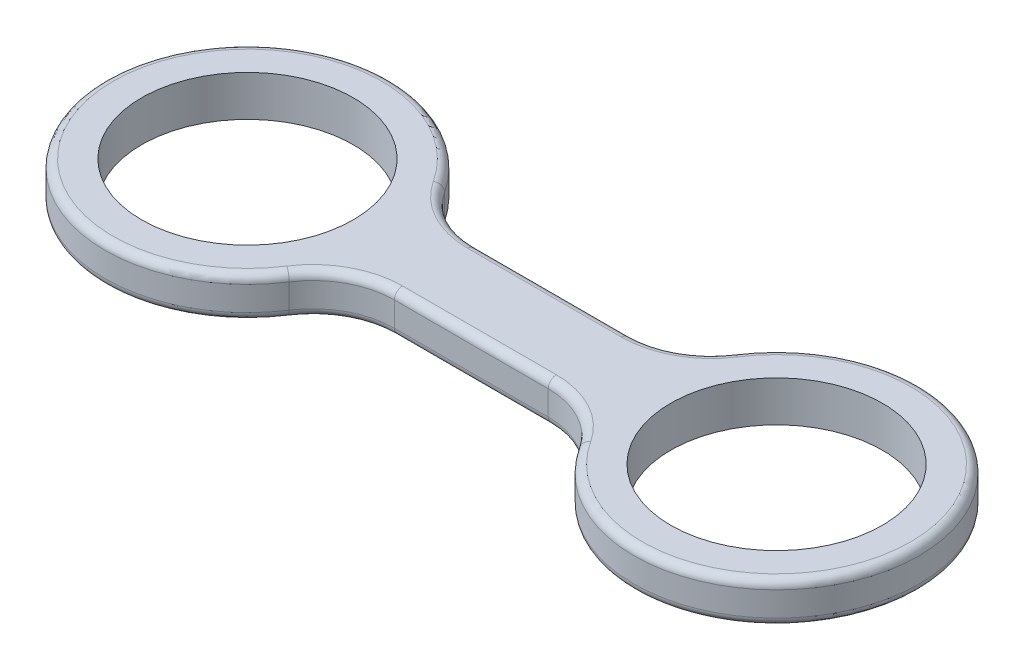
from build123d import *

# Parameters (mm, degrees)
SKETCH1_R           = 13
BOSS_EXTRUDE1_DEPTH = 5
FILLET1_R           = 10
FILLET2_R           = 1


with BuildPart() as part:
    # Sketch1 → Boss-Extrude1 (new body)
    with BuildSketch(Plane(origin=(0, 0, 0), x_dir=(1, 0, 0), z_dir=(0, 1, 0))):
        with BuildLine():
            Line((16.770509831, 5), (48.229490169, 5))
            ThreePointArc((48.229490169, 5), (82.5, 0), (48.229490169, -5))
            Line((48.229490169, -5), (16.770509831, -5))
            ThreePointArc((16.770509831, -5), (-17.5, 0), (16.770509831, 5))
        make_face()
        with Locations(Location((0, 0, 0), (0, 0, 270))):
            Circle(SKETCH1_R, mode=Mode.SUBTRACT)
        with Locations(Location((65, 0, 0), (0, 0, 270))):
            Circle(SKETCH1_R, mode=Mode.SUBTRACT)
    extrude(amount=BOSS_EXTRUDE1_DEPTH)

    # Fillet1
    fillet1_edges = [part.edges().sort_by_distance(p)[0] for p in [
        (16.770509831, 2.5, -5),
        (48.229490169, 2.5, -5),
        (48.229490169, 2.5, 5),
        (16.770509831, 2.5, 5),
    ]]
    fillet(fillet1_edges, radius=FILLET1_R)

    # Fillet2
    fillet2_edges = [part.edges().sort_by_distance(p)[0] for p in [
        (82.5, 0, 0),
        (82.5, 5, 0),
        (32.5, 0, 5),
        (32.5, 5, 5),
        (-17.5, 0, 0),
        (-17.5, 5, 0),
        (32.5, 0, -5),
        (32.5, 5, -5),
        (46.718451803, 0, 6.20950927),
        (46.718451803, 5, 6.20950927),
        (18.281548197, 0, 6.20950927),
        (18.281548197, 5, 6.20950927),
        (46.718451803, 0, -6.20950927),
        (46.718451803, 5, -6.20950927),
        (18.281548197, 0, -6.20950927),
        (18.281548197, 5, -6.20950927),
    ]]
    fillet(fillet2_edges, radius=FILLET2_R)


solid = part.part
